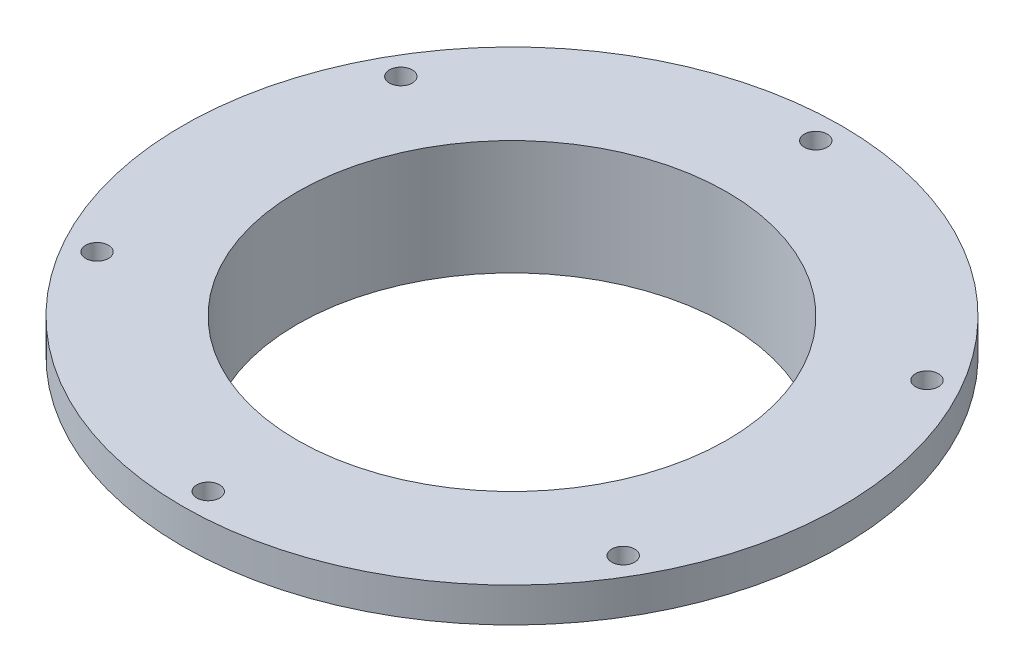
from build123d import *

# Parameters (mm, degrees)
SKETCH2_R          = 2
CUT_EXTRUDE1_DEPTH = 84.740671122


with BuildPart() as part:
    # Sketch1 → Revolve1 (revolve)
    with BuildSketch(Plane(origin=(0, 0, 0), x_dir=(0, 0, -1), z_dir=(1, 0, 0))):
        Polygon((37.5, 66.401492208), (57.5, 80.368434357), (57.5, 86.401492208), (37.5, 86.401492208), align=None)
    revolve(axis=Axis((0, 0, 0), (0, 1, 0)))

    # Sketch2 → Cut-Extrude1 (cut, through all)
    with BuildSketch(Plane(origin=(0, 86.401492208, 0), x_dir=(1, 0, 0), z_dir=(0, 1, 0))):
        with Locations(Location((0, -53, 0), (0, 0, 270))):
            Circle(SKETCH2_R)
        with Locations(Location((-45.899346401, -26.5, 0), (0, 0, 270))):
            Circle(SKETCH2_R)
        with Locations(Location((-45.899346401, 26.5, 0), (0, 0, 270))):
            Circle(SKETCH2_R)
        with Locations(Location((0, 53, 0), (0, 0, 270))):
            Circle(SKETCH2_R)
        with Locations(Location((45.899346401, 26.5, 0), (0, 0, 270))):
            Circle(SKETCH2_R)
        with Locations(Location((45.899346401, -26.5, 0), (0, 0, 270))):
            Circle(SKETCH2_R)
    extrude(amount=-CUT_EXTRUDE1_DEPTH, mode=Mode.SUBTRACT)


solid = part.part
